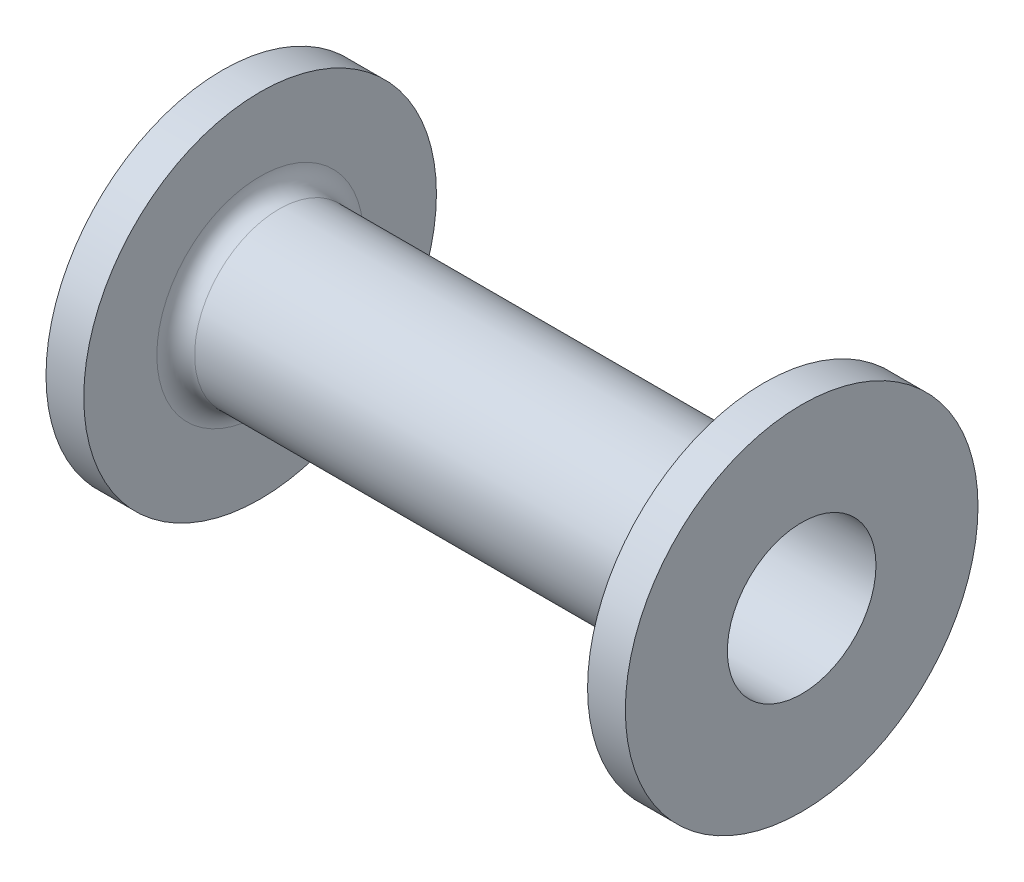
from build123d import *


with BuildPart() as part:
    # Sketch1 → Revolve1 (revolve)
    with BuildSketch(Plane.XY, mode=Mode.PRIVATE) as revolve1_sk:
        with BuildLine():
            Line((0, 5.9), (0, 14))
            Line((0, 14), (3, 14))
            Line((3, 14), (3, 8.2))
            ThreePointArc((3, 8.2), (3.439339828, 7.139339828), (4.5, 6.7))
            Line((4.5, 6.7), (41.5, 6.7))
            ThreePointArc((41.5, 6.7), (42.560660172, 7.139339828), (43, 8.2))
            Line((43, 8.2), (43, 14))
            Line((43, 14), (46, 14))
            Line((46, 14), (46, 5.9))
            Line((46, 5.9), (43, 5.9))
            Line((43, 5.9), (3, 5.9))
            Line((3, 5.9), (0, 5.9))
        make_face()
    revolve(revolve1_sk.sketch.rotate(Axis((0, 0, 0), (-1, 0, 0)), 90), axis=Axis((0, 0, 0), (-1, 0, 0)))


solid = part.part
